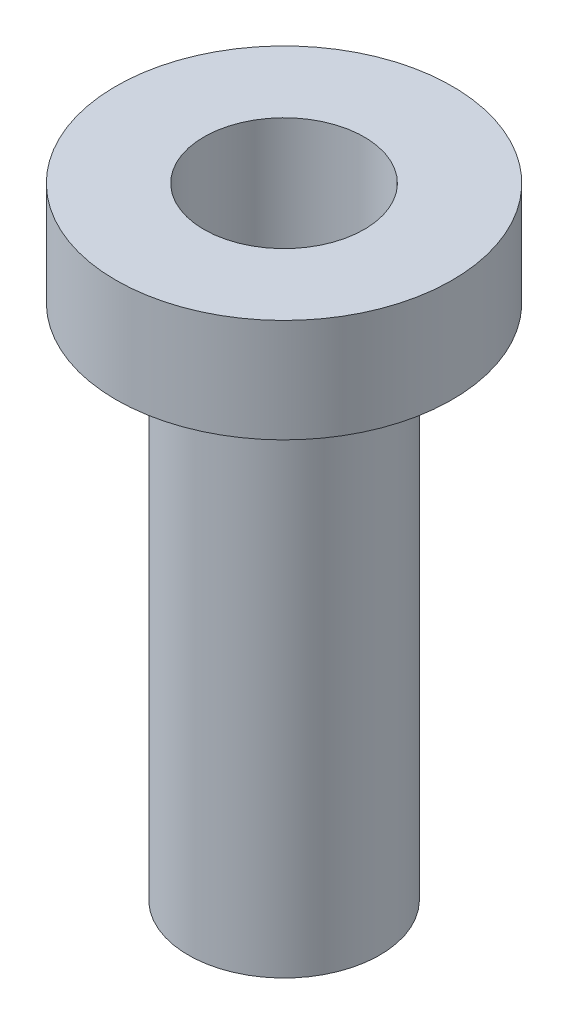
from build123d import *

# Parameters (mm, degrees)
SKETCH1_R           = 3.25
BOSS_EXTRUDE1_DEPTH = 2
SKETCH2_R           = 1.85
BOSS_EXTRUDE2_DEPTH = 10
SKETCH3_R           = 1.55
CUT_EXTRUDE1_DEPTH  = 13.850097276


with BuildPart() as part:
    # Sketch1 → Boss-Extrude1 (new body)
    with BuildSketch(Plane(origin=(0, 0, 0), x_dir=(1, 0, 0), z_dir=(0, 1, 0))):
        with Locations(Location((0, 0, 0), (0, 0, 270))):
            Circle(SKETCH1_R)
    extrude(amount=BOSS_EXTRUDE1_DEPTH)

    # Sketch2 → Boss-Extrude2 (add)
    with BuildSketch(Plane(origin=(0, 0, 0), x_dir=(-1, 0, 0), z_dir=(0, -1, 0))):
        with Locations(Location((0, 0, 0), (0, 0, 90))):
            Circle(SKETCH2_R)
    extrude(amount=BOSS_EXTRUDE2_DEPTH)

    # Sketch3 → Cut-Extrude1 (cut, through all)
    with BuildSketch(Plane(origin=(0, 2, 0), x_dir=(1, 0, 0), z_dir=(0, 1, 0))):
        with Locations(Location((0, 0, 0), (0, 0, 270))):
            Circle(SKETCH3_R)
    extrude(amount=-CUT_EXTRUDE1_DEPTH, mode=Mode.SUBTRACT)


solid = part.part
